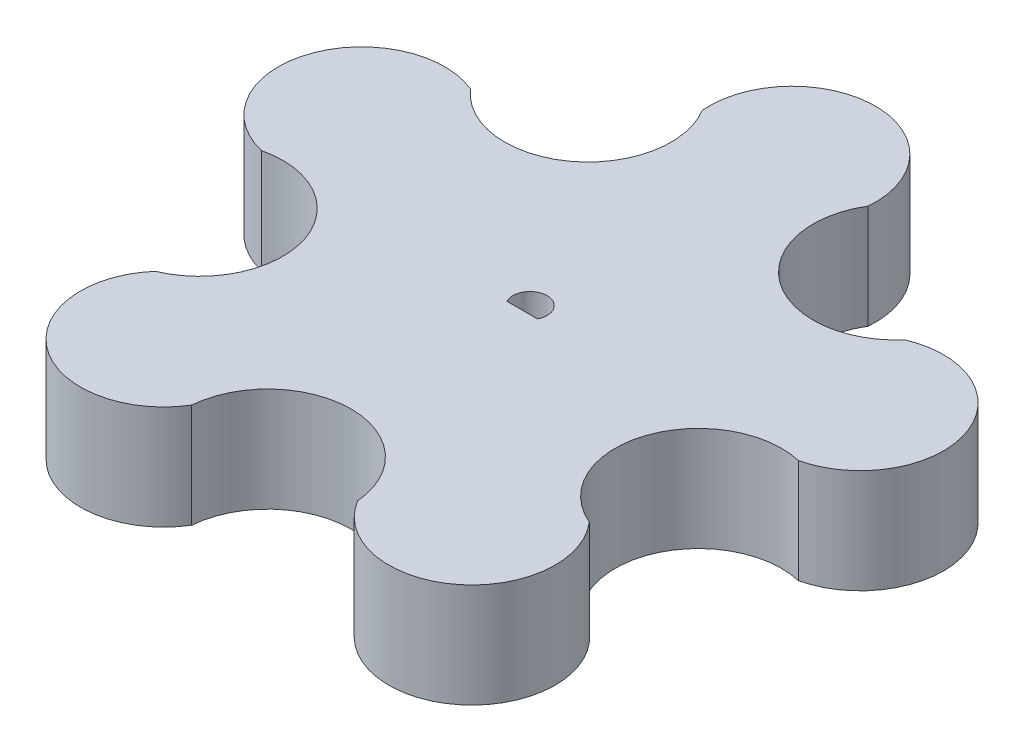
from build123d import *

# Parameters (mm, degrees)
BOSS_EXTRUDE1_DEPTH = 6.35
CUT_EXTRUDE1_DEPTH  = 87.982615074


with BuildPart() as part:
    # Sketch5 → Boss-Extrude1 (new body)
    with BuildSketch(Plane(origin=(0, 0, 0), x_dir=(1, 0, 0), z_dir=(0, 1, 0))):
        with BuildLine():
            ThreePointArc((63.790074828, 30.282665757), (58.727566665, 35.783867727), (53.665058502, 30.282665757))
            ThreePointArc((53.665058502, 30.282665757), (52.307776139, 23.537951339), (45.473748225, 24.331330481))
            ThreePointArc((45.473748225, 24.331330481), (38.677393188, 21.216564002), (42.344946112, 14.701867727))
            ThreePointArc((42.344946112, 14.701867727), (48.340127394, 11.326784114), (45.473748225, 5.072404972))
            ThreePointArc((45.473748225, 5.072404972), (46.335877976, -2.353828549), (53.665058502, -0.878930303))
            ThreePointArc((53.665058502, -0.878930303), (58.727566665, 3.779867727), (63.790074828, -0.878930303))
            ThreePointArc((63.790074828, -0.878930303), (71.119255353, -2.353828549), (71.981385104, 5.072404972))
            ThreePointArc((71.981385104, 5.072404972), (69.115005936, 11.326784114), (75.110187217, 14.701867727))
            ThreePointArc((75.110187217, 14.701867727), (78.777740141, 21.216564002), (71.981385104, 24.331330481))
            ThreePointArc((71.981385104, 24.331330481), (65.14735719, 23.537951339), (63.790074828, 30.282665757))
        make_face()
    extrude(amount=BOSS_EXTRUDE1_DEPTH)

    # Sketch6 → Cut-Extrude1 (cut, through all)
    with BuildSketch(Plane(origin=(0, 0, 0), x_dir=(1, 0, 0), z_dir=(0, 1, 0))):
        with BuildLine():
            Line((57.794311073, 14.225617727), (59.660822257, 14.225617727))
            ThreePointArc((59.660822257, 14.225617727), (58.727566665, 15.749617727), (57.794311073, 14.225617727))
        make_face()
    extrude(amount=CUT_EXTRUDE1_DEPTH, mode=Mode.SUBTRACT)


solid = part.part
